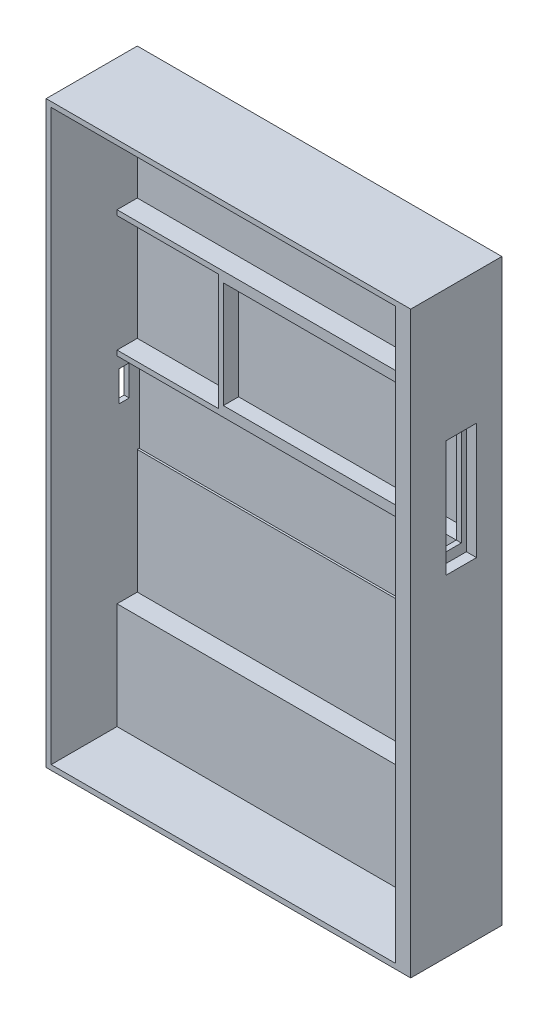
from build123d import *

# Parameters (mm, degrees)
SKICA1_W                       = 57.8
SKICA1_H                       = 44.4
SKICA1_W_2                     = 55.8
SKICA1_H_2                     = 42.4
VYSUNOUT_TENKOST_NN_1_DEPTH    = 18
SKICA1_2_W                     = 55.8
SKICA1_2_H                     = 42.4
P_IDAT_VYSUNUT_M1_DEPTH        = 1
SKICA2_W                       = 55.8
SKICA2_H                       = 1
ODEBRAT_VYSUNUT_M3_DEPTH       = 13
SKICA3_W                       = 2
SKICA3_H                       = 6
ODEBRAT_VYSUNUT_M4_DEPTH       = 10
SKICA4_W                       = 55.8
SKICA4_H                       = 18
ODEBRAT_VYSUNUT_M5_DEPTH       = 0.4
SKICA5_W                       = 22
SKICA5_H                       = 25
SKICA5_W_2                     = 20
SKICA5_H_2                     = 23
VYSUNOUT_TENKOST_NN_2_DEPTH    = 18
SKICA5_2_W                     = 20
SKICA5_2_H                     = 23
P_IDAT_VYSUNUT_M2_DEPTH        = 1
SKICA7_W                       = 48
SKICA7_H                       = 23
SKICA7_W_2                     = 46
SKICA7_H_2                     = 21
VYSUNOUT_TENKOST_NN_3_DEPTH    = 18
SKICA7_2_W                     = 46
SKICA7_2_H                     = 21
P_IDAT_VYSUNUT_M3_DEPTH        = 2
SKICA8_W                       = 68
SKICA8_H                       = 24
P_IDAT_VYSUNUT_M4_DEPTH        = 1
SKICA8_2_W                     = 70
SKICA8_2_H                     = 26
SKICA8_2_W_2                   = 68
SKICA8_2_H_2                   = 24
VYSUNOUT_TENKOST_NN_4_DEPTH    = 18
P_IDAT_VYSUNUT_M5_DEPTH        = 18
SKICA10_W                      = 6
SKICA10_H                      = 23
ODEBRAT_VYSUNUT_M7_DEPTH       = 2
SKICA15_W                      = 55.8
SKICA15_H                      = 13
ODEBRAT_VYSUNUT_M13_DEPTH      = 40
SKICA17_W                      = 68
SKICA17_H                      = 20
P_IDAT_VYSUNUT_M6_DEPTH        = 5
P_IDAT_VYSUNUT_M7_DEPTH        = 18
ODEBRAT_VYSUNUT_M14_DEPTH      = 86.4
ODEBRAT_VYSUNUT_M14_DEPTH_BACK = 10
SKICA16_W                      = 12.2
SKICA16_H                      = 13
SKICA19_W                      = 4
SKICA19_H                      = 20
ODEBRAT_VYSUNUT_M15_DEPTH      = 2


with BuildPart() as part:
    # Skica1 → Vysunout tenkostěnný1 (new body)
    with BuildSketch(Plane.XY):
        with Locations((27.9, 21.2)):
            Rectangle(SKICA1_W, SKICA1_H)
        with Locations((27.9, 21.2)):
            Rectangle(SKICA1_W_2, SKICA1_H_2, mode=Mode.SUBTRACT)
    extrude(amount=VYSUNOUT_TENKOST_NN_1_DEPTH)

    # Skica1<2> → Přidat vysunutím1 (add)
    with BuildSketch(Plane.XY):
        with Locations((27.9, 21.2)):
            Rectangle(SKICA1_2_W, SKICA1_2_H)
    extrude(amount=P_IDAT_VYSUNUT_M1_DEPTH)

    # Skica2 → Odebrat vysunutím3 (cut)
    with BuildSketch(Plane.XY.offset(18)):
        with Locations((27.9, -0.5)):
            Rectangle(SKICA2_W, SKICA2_H)
    extrude(amount=-ODEBRAT_VYSUNUT_M3_DEPTH, mode=Mode.SUBTRACT)

    # Skica3 → Odebrat vysunutím4 (cut)
    with BuildSketch(Plane.ZY.offset(1)):
        with Locations((3.6, 37)):
            Rectangle(SKICA3_W, SKICA3_H)
    extrude(amount=-ODEBRAT_VYSUNUT_M4_DEPTH, mode=Mode.SUBTRACT)

    # Skica4 → Odebrat vysunutím5 (cut)
    with BuildSketch(Plane.XY.offset(1)):
        with Locations((27.9, 33.4)):
            Rectangle(SKICA4_W, SKICA4_H)
    extrude(amount=-ODEBRAT_VYSUNUT_M5_DEPTH, mode=Mode.SUBTRACT)

    # Skica5 → Vysunout tenkostěnný2 (add)
    with BuildSketch(Plane.XY):
        with Locations((10, 54.9)):
            Rectangle(SKICA5_W, SKICA5_H)
        with Locations((10, 54.9)):
            Rectangle(SKICA5_W_2, SKICA5_H_2, mode=Mode.SUBTRACT)
    extrude(amount=VYSUNOUT_TENKOST_NN_2_DEPTH)

    # Skica5<2> → Přidat vysunutím2 (add)
    with BuildSketch(Plane.XY):
        with Locations((10, 54.9)):
            Rectangle(SKICA5_2_W, SKICA5_2_H)
    extrude(amount=P_IDAT_VYSUNUT_M2_DEPTH)

    # Skica7 → Vysunout tenkostěnný3 (add)
    with BuildSketch(Plane.XY):
        with Locations((44, 54.9)):
            Rectangle(SKICA7_W, SKICA7_H)
        with Locations((44, 54.9)):
            Rectangle(SKICA7_W_2, SKICA7_H_2, mode=Mode.SUBTRACT)
    extrude(amount=VYSUNOUT_TENKOST_NN_3_DEPTH)

    # Skica7<2> → Přidat vysunutím3 (add)
    with BuildSketch(Plane.XY):
        with Locations((44, 54.9)):
            Rectangle(SKICA7_2_W, SKICA7_2_H)
    extrude(amount=P_IDAT_VYSUNUT_M3_DEPTH)

    # Skica8 → Přidat vysunutím4 (add)
    with BuildSketch(Plane.XY):
        with Locations((34, 79.4)):
            Rectangle(SKICA8_W, SKICA8_H)
    extrude(amount=P_IDAT_VYSUNUT_M4_DEPTH)

    # Skica8<2> → Vysunout tenkostěnný4 (add)
    with BuildSketch(Plane.XY):
        with Locations((34, 79.4)):
            Rectangle(SKICA8_2_W, SKICA8_2_H)
        with Locations((34, 79.4)):
            Rectangle(SKICA8_2_W_2, SKICA8_2_H_2, mode=Mode.SUBTRACT)
    extrude(amount=VYSUNOUT_TENKOST_NN_4_DEPTH)

    # Skica9 → Přidat vysunutím5 (add)
    with BuildSketch(Plane.XY):
        Polygon((71, 92.4), (71, -1), (56.8, -1), (56.8, 43.4), (68, 43.4), (68, 92.4), align=None)
    extrude(amount=P_IDAT_VYSUNUT_M5_DEPTH)

    # Skica10 → Odebrat vysunutím7 (cut)
    with BuildSketch(Plane(origin=(71, 0, 0), x_dir=(0, 0, -1), z_dir=(1, 0, 0))):
        with Locations((-8, 54.9)):
            Rectangle(SKICA10_W, SKICA10_H)
    extrude(amount=-ODEBRAT_VYSUNUT_M7_DEPTH, mode=Mode.SUBTRACT)

    # Skica15 → Odebrat vysunutím13 (cut)
    with BuildSketch(Plane.XZ.offset(-42.4)):
        with Locations((27.9, 11.5)):
            Rectangle(SKICA15_W, SKICA15_H)
    extrude(amount=-ODEBRAT_VYSUNUT_M13_DEPTH, mode=Mode.SUBTRACT)

    # Skica17 → Přidat vysunutím6 (add)
    with BuildSketch(Plane.XY):
        with Locations((34, -11)):
            Rectangle(SKICA17_W, SKICA17_H)
    extrude(amount=P_IDAT_VYSUNUT_M6_DEPTH)

    # Skica18 → Přidat vysunutím7 (add)
    with BuildSketch(Plane.XY):
        Polygon((-1, -22), (71, -22), (71, -1), (55.8, -1), (55.8, -21), (0, -21), (0, -1), (-1, -1), align=None)
    extrude(amount=P_IDAT_VYSUNUT_M7_DEPTH)

    # Skica16 → Odebrat vysunutím14 (cut, two sides: drawn at the far end of the back side and taken through both)
    with BuildSketch(Plane.XZ.offset(-65.4).offset(-ODEBRAT_VYSUNUT_M14_DEPTH_BACK)):
        with Locations((61.9, 11.5)):
            Rectangle(SKICA16_W, SKICA16_H)
    extrude(amount=ODEBRAT_VYSUNUT_M14_DEPTH + ODEBRAT_VYSUNUT_M14_DEPTH_BACK, mode=Mode.SUBTRACT)

    # Skica19 → Odebrat vysunutím15 (cut)
    with BuildSketch(Plane(origin=(69, 0, 0), x_dir=(0, 0, -1), z_dir=(1, 0, 0))):
        with Locations((-8, 55.4)):
            Rectangle(SKICA19_W, SKICA19_H)
    extrude(amount=-ODEBRAT_VYSUNUT_M15_DEPTH, mode=Mode.SUBTRACT)


solid = part.part
